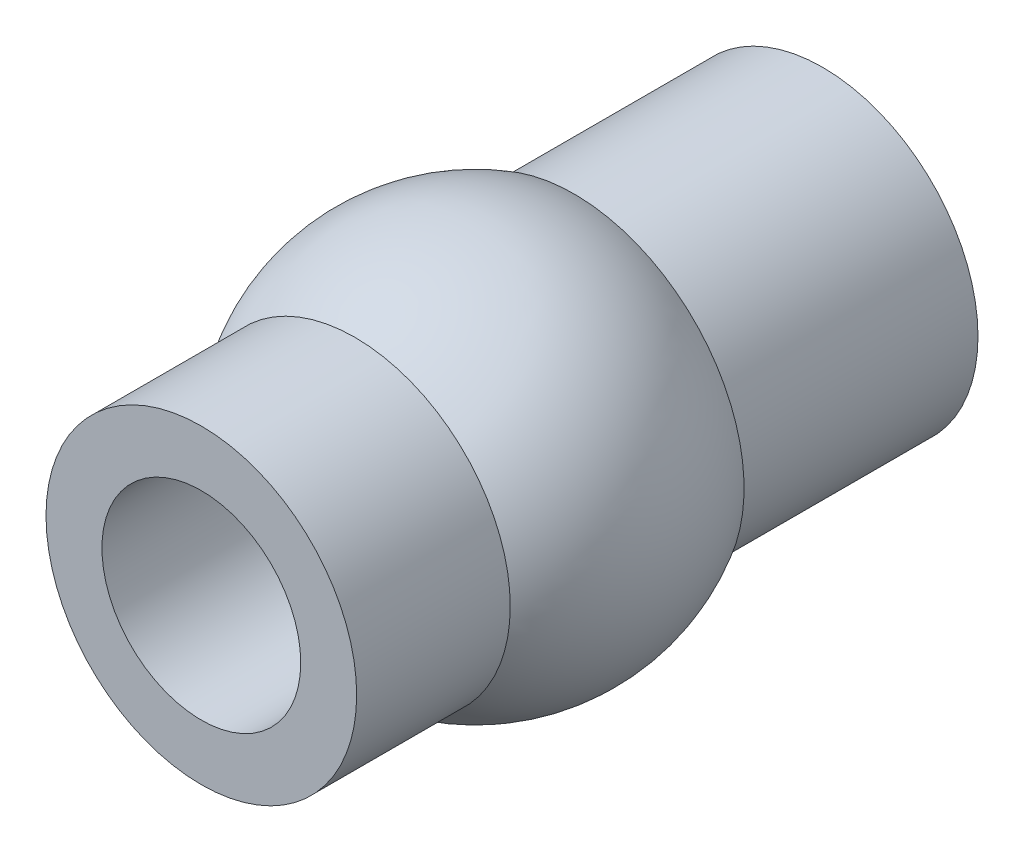
from build123d import *

# Parameters (mm, degrees)
SKETCH_1_R          = 2.5
EXTRUDE_1_DEPTH     = 10
SKETCH_3_R          = 1.6
CUT_EXTRUDE_1_DEPTH = 11.955148971


with BuildPart() as part:
    # 草图1 → 凸台-拉伸1 (new body)
    with BuildSketch(Plane.XY):
        Circle(SKETCH_1_R)
    extrude(amount=EXTRUDE_1_DEPTH)

    # 草图2 → 旋转1 (revolve)
    with BuildSketch(Plane(origin=(0, 0, 0), x_dir=(1, 0, 0), z_dir=(0, 1, 0))):
        with BuildLine():
            Line((0, -8), (-2.048968216, -8))
            ThreePointArc((-2.048968216, -8), (-3.117957315, -6.124512969), (-2.735029198, -4))
            Line((-2.735029198, -4), (0, -4))
            Line((0, -4), (0, -8))
        make_face()
    revolve(axis=Axis((0, 0, 8), (0, 0, -1)))

    # 草图3 → 切除-拉伸1 (cut, through all)
    with BuildSketch(Plane.XY.offset(10)):
        Circle(SKETCH_3_R)
    extrude(amount=-CUT_EXTRUDE_1_DEPTH, mode=Mode.SUBTRACT)


solid = part.part
